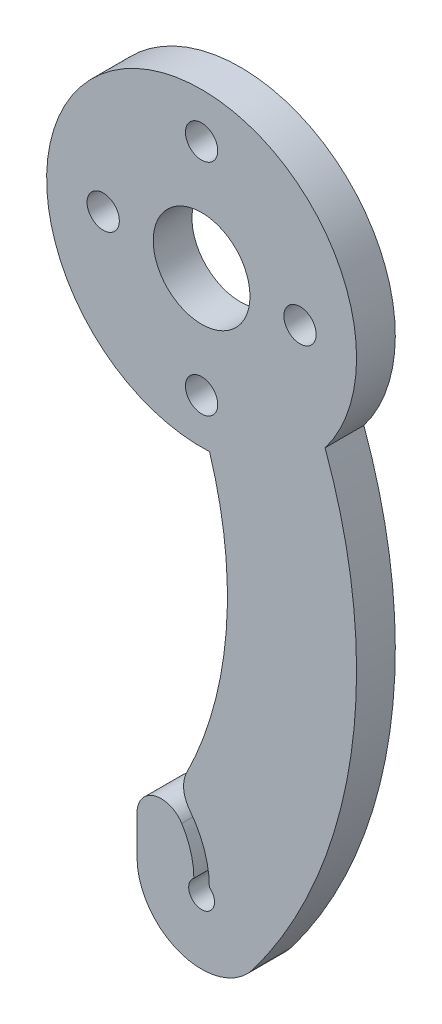
from build123d import *

# Parameters (mm, degrees)
SKETCH1_R           = 3.7465
SKETCH1_R_2         = 1.25
BOSS_EXTRUDE1_DEPTH = 3


with BuildPart() as part:
    # Sketch1 → Boss-Extrude1 (new body)
    with BuildSketch(Plane.XY):
        with BuildLine():
            Line((-5, -42), (-5, -39))
            ThreePointArc((-5, -39), (-3.64832327, -37.196831118), (-1.538417978, -37.988505079))
            ThreePointArc((-1.538417978, -37.988505079), (-0.839409352, -39.527103714), (-0.6, -41.2))
            ThreePointArc((-0.6, -41.2), (0, -43), (0.6, -41.2))
            ThreePointArc((0.6, -41.2), (0.210597624, -38.870174368), (-0.915279992, -36.793609589))
            ThreePointArc((-0.915279992, -36.793609589), (-1.38227286, -35.62821691), (-1.15567211, -34.393358808))
            ThreePointArc((-1.15567211, -34.393358808), (1.906967722, -23.36077989), (0.613240327, -11.984320436))
            ThreePointArc((0.613240327, -11.984320436), (-5.611566101, 10.607088474), (9.562398428, -7.249864571))
            ThreePointArc((9.562398428, -7.249864571), (11.572717875, -26.830951895), (4, -45))
            ThreePointArc((4, -45), (-1.58113883, -46.74341649), (-5, -42))
        make_face()
        Circle(SKETCH1_R, mode=Mode.SUBTRACT)
        with Locations((0, 8.509)):
            Circle(SKETCH1_R_2, mode=Mode.SUBTRACT)
        with Locations((-7.62, 0)):
            Circle(SKETCH1_R_2, mode=Mode.SUBTRACT)
        with Locations((0, -8.509)):
            Circle(SKETCH1_R_2, mode=Mode.SUBTRACT)
        with Locations((7.62, 0)):
            Circle(SKETCH1_R_2, mode=Mode.SUBTRACT)
    extrude(amount=BOSS_EXTRUDE1_DEPTH)


solid = part.part
